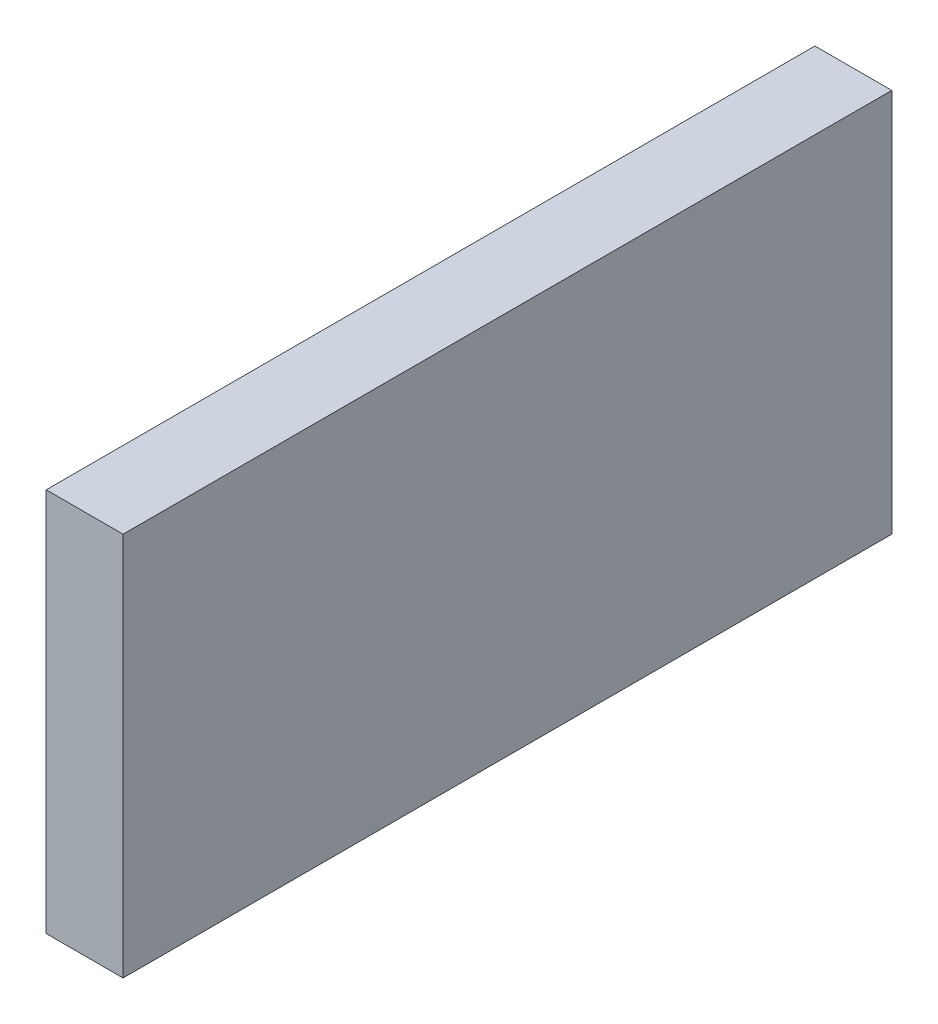
from build123d import *

# Parameters (mm, degrees)
SKETCH1_W           = 40
SKETCH1_H           = 20
BOSS_EXTRUDE1_DEPTH = 4


with BuildPart() as part:
    # Sketch1 → Boss-Extrude1 (new body)
    with BuildSketch(Plane(origin=(0, 0, 0), x_dir=(0, 0, -1), z_dir=(1, 0, 0))):
        with Locations((20, 10)):
            Rectangle(SKETCH1_W, SKETCH1_H)
    extrude(amount=BOSS_EXTRUDE1_DEPTH)


solid = part.part
